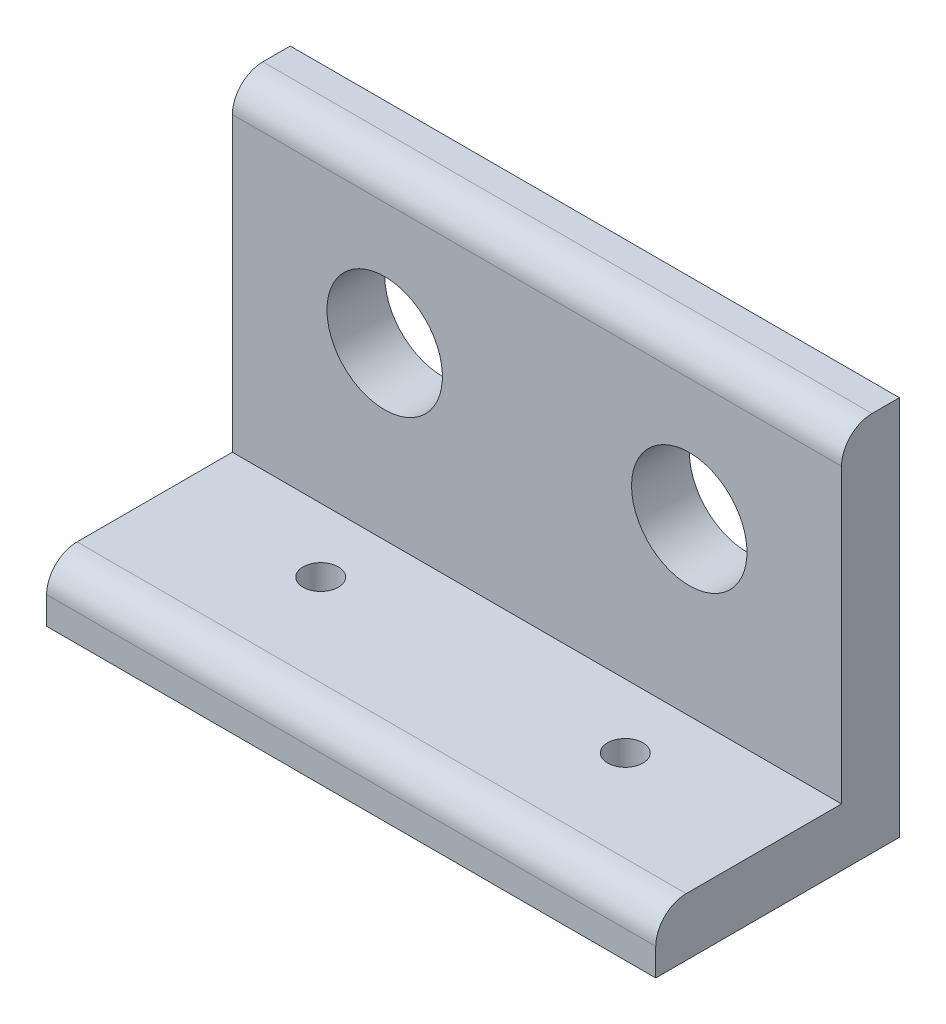
from build123d import *

# Parameters (mm, degrees)
SKETCH1_W           = 50.8
SKETCH1_H           = 20.32
SKETCH1_R           = 1.4732
BOSS_EXTRUDE1_DEPTH = 4.826
SKETCH2_W           = 50.8
SKETCH2_H           = 4.826
BOSS_EXTRUDE2_DEPTH = 26.924
FILLET1_R           = 2.54
SKETCH3_R           = 4.8133
CUT_EXTRUDE1_DEPTH  = 26.924


with BuildPart() as part:
    # Sketch1 → Boss-Extrude1 (new body)
    with BuildSketch(Plane(origin=(0, 0, 0), x_dir=(1, 0, 0), z_dir=(0, 1, 0))):
        with Locations((25.4, 10.16)):
            Rectangle(SKETCH1_W, SKETCH1_H)
        with Locations(Location((12.7, 10.16, 0), (0, 0, 270))):
            Circle(SKETCH1_R, mode=Mode.SUBTRACT)
        with Locations(Location((38.1, 10.16, 0), (0, 0, 270))):
            Circle(SKETCH1_R, mode=Mode.SUBTRACT)
    extrude(amount=BOSS_EXTRUDE1_DEPTH)

    # Sketch2 → Boss-Extrude2 (add)
    with BuildSketch(Plane(origin=(0, 4.826, 0), x_dir=(1, 0, 0), z_dir=(0, 1, 0))):
        with Locations((25.4, 17.907)):
            Rectangle(SKETCH2_W, SKETCH2_H)
    extrude(amount=BOSS_EXTRUDE2_DEPTH)

    # Fillet1
    fillet1_edges = [part.edges().sort_by_distance(p)[0] for p in [
        (25.4, 31.75, -15.494),
        (25.4, 4.826, 0),
    ]]
    fillet(fillet1_edges, radius=FILLET1_R)

    # Sketch3 → Cut-Extrude1 (cut)
    with BuildSketch(Plane(origin=(0, 0, -20.32), x_dir=(-1, 0, 0), z_dir=(0, 0, -1))):
        with Locations((-38.1, 19.05)):
            Circle(SKETCH3_R)
        with Locations((-12.7, 19.05)):
            Circle(SKETCH3_R)
    extrude(amount=-CUT_EXTRUDE1_DEPTH, mode=Mode.SUBTRACT)


solid = part.part
